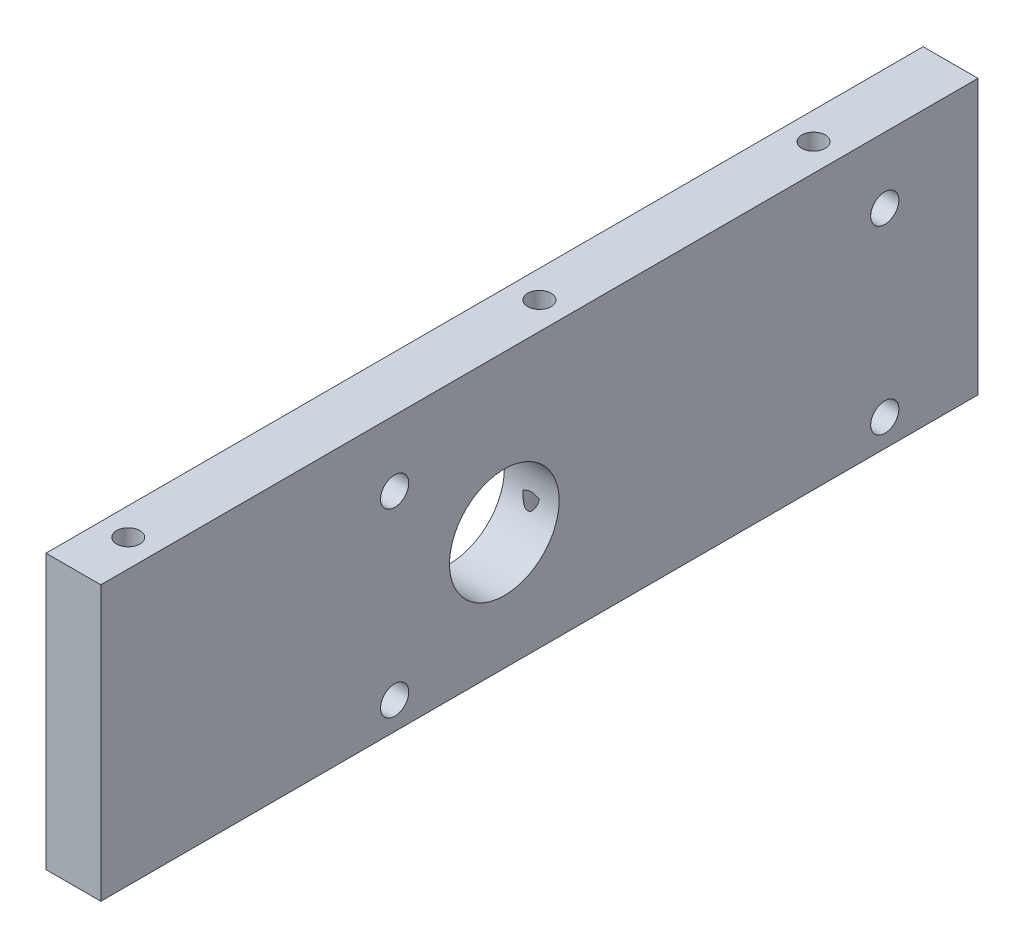
from build123d import *

# Parameters (mm, degrees)
SKETCH1_W                          = 101.6
SKETCH1_H                          = 31.75
BOSS_EXTRUDE1_DEPTH                = 3.175
CUT_EXTRUDE1_REACH                 = 55.6
SKETCH2_R                          = 1.63195
SKETCH2_R_2                        = 6.35
TAP_DRILL_FOR_6_32_TAP1_AT_2_COUNT = 2
TAP_DRILL_FOR_6_32_TAP1_AT_2_PITCH = 79.375
TAP_DRILL_FOR_6_32_TAP1_AT_3_COUNT = 2
TAP_DRILL_FOR_6_32_TAP1_AT_3_PITCH = 47.625


with BuildPart() as part:
    # Sketch1 → Boss-Extrude1 (new, symmetric)
    with BuildSketch(Plane(origin=(0, 0, 0), x_dir=(0, 0, -1), z_dir=(1, 0, 0))):
        Rectangle(SKETCH1_W, SKETCH1_H)
    extrude(amount=BOSS_EXTRUDE1_DEPTH, both=True)

    # Sketch2 → Cut-Extrude1 (cut, up to next)
    with BuildSketch(Plane(origin=(3.175, 0, 0), x_dir=(0, 0, -1), z_dir=(1, 0, 0)), mode=Mode.PRIVATE) as cut_extrude1_sk1:
        with Locations((-16.764, 8.255)):
            Circle(SKETCH2_R)
    cut_extrude1_tool1 = extrude(cut_extrude1_sk1.sketch, amount=-CUT_EXTRUDE1_REACH, mode=Mode.PRIVATE) & part.part
    # Sketch2 → Cut-Extrude1 (cut, up to next)
    with BuildSketch(Plane(origin=(3.175, 0, 0), x_dir=(0, 0, -1), z_dir=(1, 0, 0)), mode=Mode.PRIVATE) as cut_extrude1_sk2:
        with Locations((-16.764, -12.7)):
            Circle(SKETCH2_R)
    cut_extrude1_tool2 = extrude(cut_extrude1_sk2.sketch, amount=-CUT_EXTRUDE1_REACH, mode=Mode.PRIVATE) & part.part
    # Sketch2 → Cut-Extrude1 (cut, up to next)
    with BuildSketch(Plane(origin=(3.175, 0, 0), x_dir=(0, 0, -1), z_dir=(1, 0, 0)), mode=Mode.PRIVATE) as cut_extrude1_sk3:
        with Locations((40.005, -12.7)):
            Circle(SKETCH2_R)
    cut_extrude1_tool3 = extrude(cut_extrude1_sk3.sketch, amount=-CUT_EXTRUDE1_REACH, mode=Mode.PRIVATE) & part.part
    # Sketch2 → Cut-Extrude1 (cut, up to next)
    with BuildSketch(Plane(origin=(3.175, 0, 0), x_dir=(0, 0, -1), z_dir=(1, 0, 0)), mode=Mode.PRIVATE) as cut_extrude1_sk4:
        with Locations((40.005, 8.255)):
            Circle(SKETCH2_R)
    cut_extrude1_tool4 = extrude(cut_extrude1_sk4.sketch, amount=-CUT_EXTRUDE1_REACH, mode=Mode.PRIVATE) & part.part
    # Sketch2 → Cut-Extrude1 (cut, up to next)
    with BuildSketch(Plane(origin=(3.175, 0, 0), x_dir=(0, 0, -1), z_dir=(1, 0, 0)), mode=Mode.PRIVATE) as cut_extrude1_sk5:
        with Locations((-4.064, -2.2225)):
            Circle(SKETCH2_R_2)
    cut_extrude1_tool5 = extrude(cut_extrude1_sk5.sketch, amount=-CUT_EXTRUDE1_REACH, mode=Mode.PRIVATE) & part.part
    add(cut_extrude1_tool1.solids().sort_by_distance((3.175, 8.255, 16.764))[0], mode=Mode.SUBTRACT)
    add(cut_extrude1_tool2.solids().sort_by_distance((3.175, -12.7, 16.764))[0], mode=Mode.SUBTRACT)
    add(cut_extrude1_tool3.solids().sort_by_distance((3.175, -12.7, -40.005))[0], mode=Mode.SUBTRACT)
    add(cut_extrude1_tool4.solids().sort_by_distance((3.175, 8.255, -40.005))[0], mode=Mode.SUBTRACT)
    add(cut_extrude1_tool5.solids().sort_by_distance((3.175, -2.2225, 4.064))[0], mode=Mode.SUBTRACT)

    # Sketch5 → Tap Drill for #6-32 Tap1 (revolve, cut)
    with BuildSketch(Plane(origin=(0, 15.875, 44.45), x_dir=(0, 0, 1), z_dir=(1, 0, 0))):
        Polygon((0, 0), (0, 13.51269403), (1.35255, 12.7), (1.35255, 0), align=None)
    tap_drill_for_6_32_tap1 = revolve(axis=Axis((0, 22.225, 44.45), (0, -1, 0)), mode=Mode.SUBTRACT)

    # Tap Drill for #6-32 Tap1 at 2: Tap Drill for #6-32 Tap1 ×2
    with Locations(*[(0, 0, -i * TAP_DRILL_FOR_6_32_TAP1_AT_2_PITCH) for i in range(1, TAP_DRILL_FOR_6_32_TAP1_AT_2_COUNT)]):
        add(tap_drill_for_6_32_tap1, mode=Mode.SUBTRACT)

    # Tap Drill for #6-32 Tap1 at 3: Tap Drill for #6-32 Tap1 ×2
    with Locations(*[(0, 0, -i * TAP_DRILL_FOR_6_32_TAP1_AT_3_PITCH) for i in range(1, TAP_DRILL_FOR_6_32_TAP1_AT_3_COUNT)]):
        add(tap_drill_for_6_32_tap1, mode=Mode.SUBTRACT)

    # Mirror1: Tap Drill for #6-32 Tap1 across plane
    add(tap_drill_for_6_32_tap1.mirror(Plane.ZX), mode=Mode.SUBTRACT)

    # Mirror1 copy 1 sketch → Mirror1 copy 1 (revolve, cut)
    with BuildSketch(Plane(origin=(0, -15.875, -34.925), x_dir=(0, 0, 1), z_dir=(1, 0, 0))):
        Polygon((0, 0), (0, -13.51269403), (1.35255, -12.7), (1.35255, 0), align=None)
    revolve(axis=Axis((0, -22.225, -34.925), (0, -1, 0)), mode=Mode.SUBTRACT)

    # Mirror1 copy 2 sketch → Mirror1 copy 2 (revolve, cut)
    with BuildSketch(Plane(origin=(0, -15.875, -3.175), x_dir=(0, 0, 1), z_dir=(1, 0, 0))):
        Polygon((0, 0), (0, -13.51269403), (1.35255, -12.7), (1.35255, 0), align=None)
    revolve(axis=Axis((0, -22.225, -3.175), (0, -1, 0)), mode=Mode.SUBTRACT)


solid = part.part
